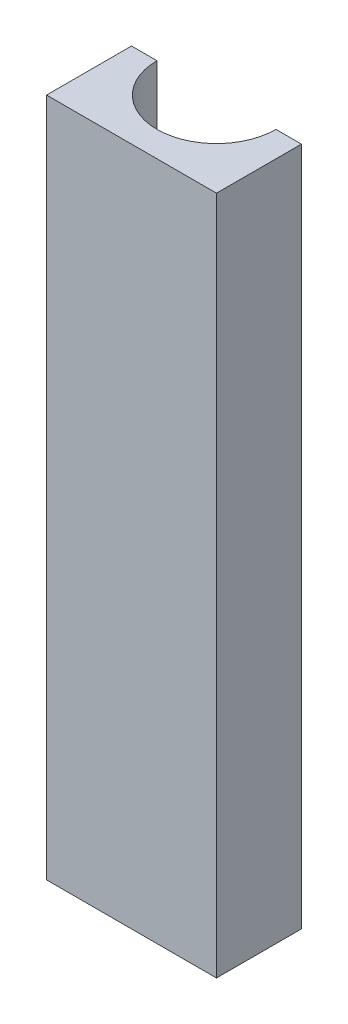
from build123d import *

# Parameters (mm, degrees)
SCHIZZO1_W                   = 20
SCHIZZO1_H                   = 10
ESTRUSIONE_ESTRUSIONE1_DEPTH = 80
SCHIZZO3_R                   = 7
TAGLIO_ESTRUSIONE1_DEPTH     = 84.066238629


with BuildPart() as part:
    # Schizzo1 → Estrusione-Estrusione1 (new body)
    with BuildSketch(Plane(origin=(0, 0, 0), x_dir=(1, 0, 0), z_dir=(0, 1, 0))):
        with Locations((10, 5)):
            Rectangle(SCHIZZO1_W, SCHIZZO1_H)
    extrude(amount=ESTRUSIONE_ESTRUSIONE1_DEPTH)

    # Schizzo3 → Taglio-Estrusione1 (cut, through all)
    with BuildSketch(Plane(origin=(0, 80, 0), x_dir=(1, 0, 0), z_dir=(0, 1, 0))):
        with Locations((10, 10)):
            Circle(SCHIZZO3_R)
    extrude(amount=-TAGLIO_ESTRUSIONE1_DEPTH, mode=Mode.SUBTRACT)


solid = part.part
